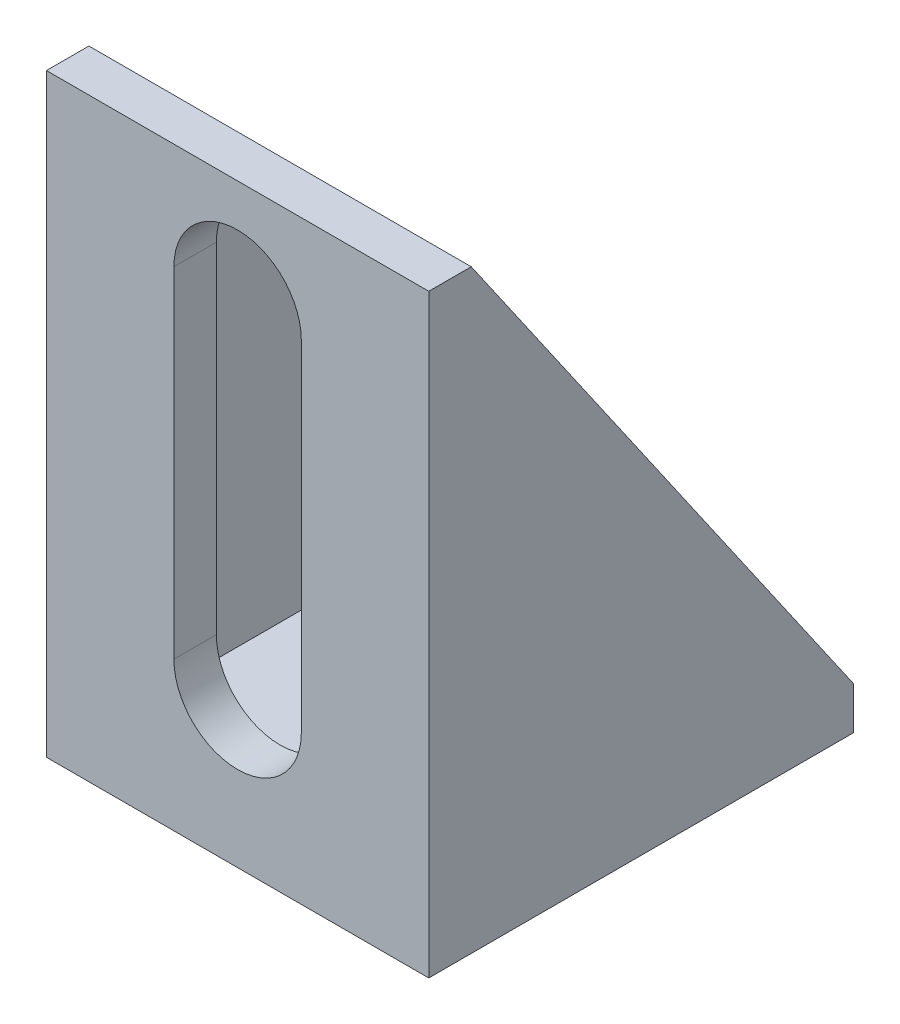
from build123d import *

# Parameters (mm, degrees)
EXTRUDE_1_DEPTH     = 18
SKETCH_2_W          = 14
SKETCH_2_H          = 26
CUT_EXTRUDE_1_DEPTH = 18
CUT_EXTRUDE_2_DEPTH = 18
SKETCH_4_R          = 3
CUT_EXTRUDE_3_DEPTH = 18


with BuildPart() as part:
    # 스케치1 → 보스-돌출1 (new body)
    with BuildSketch(Plane(origin=(0, 0, 0), x_dir=(0, 0, -1), z_dir=(1, 0, 0))):
        Polygon((0, 0), (20, 0), (20, 2), (2, 28), (0, 28), align=None)
    extrude(amount=EXTRUDE_1_DEPTH)

    # 스케치2 → 컷-돌출1 (cut)
    with BuildSketch(Plane(origin=(0, 0, -20), x_dir=(-1, 0, 0), z_dir=(0, 0, -1))):
        with Locations((-9, 15)):
            Rectangle(SKETCH_2_W, SKETCH_2_H)
    extrude(amount=-CUT_EXTRUDE_1_DEPTH, mode=Mode.SUBTRACT)

    # 스케치3 → 컷-돌출2 (cut)
    with BuildSketch(Plane(origin=(0, 0, -2), x_dir=(-1, 0, 0), z_dir=(0, 0, -1))):
        with BuildLine():
            Line((-6, 23), (-6, 7))
            ThreePointArc((-6, 7), (-9, 4), (-12, 7))
            Line((-12, 7), (-12, 23))
            ThreePointArc((-12, 23), (-9, 26), (-6, 23))
        make_face()
    extrude(amount=-CUT_EXTRUDE_2_DEPTH, mode=Mode.SUBTRACT)

    # 스케치4 → 컷-돌출3 (cut)
    with BuildSketch(Plane(origin=(0, 2, 0), x_dir=(1, 0, 0), z_dir=(0, 1, 0))):
        with Locations(Location((9, 11, 0), (0, 0, 270))):
            Circle(SKETCH_4_R)
    extrude(amount=-CUT_EXTRUDE_3_DEPTH, mode=Mode.SUBTRACT)


solid = part.part
